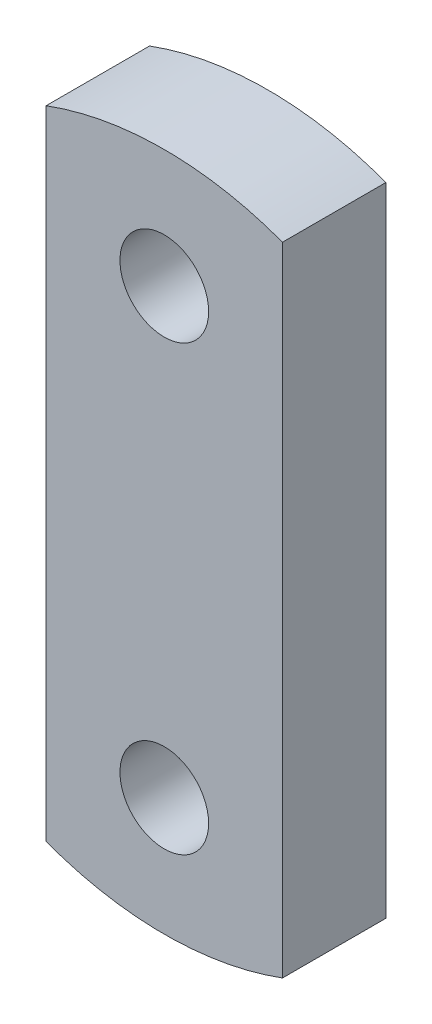
from build123d import *

# Parameters (mm, degrees)
SKETCH1_R           = 15
BOSS_EXTRUDE1_DEPTH = 35


with BuildPart() as part:
    # Sketch1 → Boss-Extrude1 (new body)
    with BuildSketch(Plane.XY):
        with BuildLine():
            Line((-40, 107.819293264), (-40, -107.819293264))
            ThreePointArc((-40, -107.819293264), (0, -115), (40, -107.819293264))
            Line((40, -107.819293264), (40, 107.819293264))
            ThreePointArc((40, 107.819293264), (0, 115), (-40, 107.819293264))
        make_face()
        with Locations((0, -75)):
            Circle(SKETCH1_R, mode=Mode.SUBTRACT)
        with Locations((0, 75)):
            Circle(SKETCH1_R, mode=Mode.SUBTRACT)
    extrude(amount=BOSS_EXTRUDE1_DEPTH)


solid = part.part
